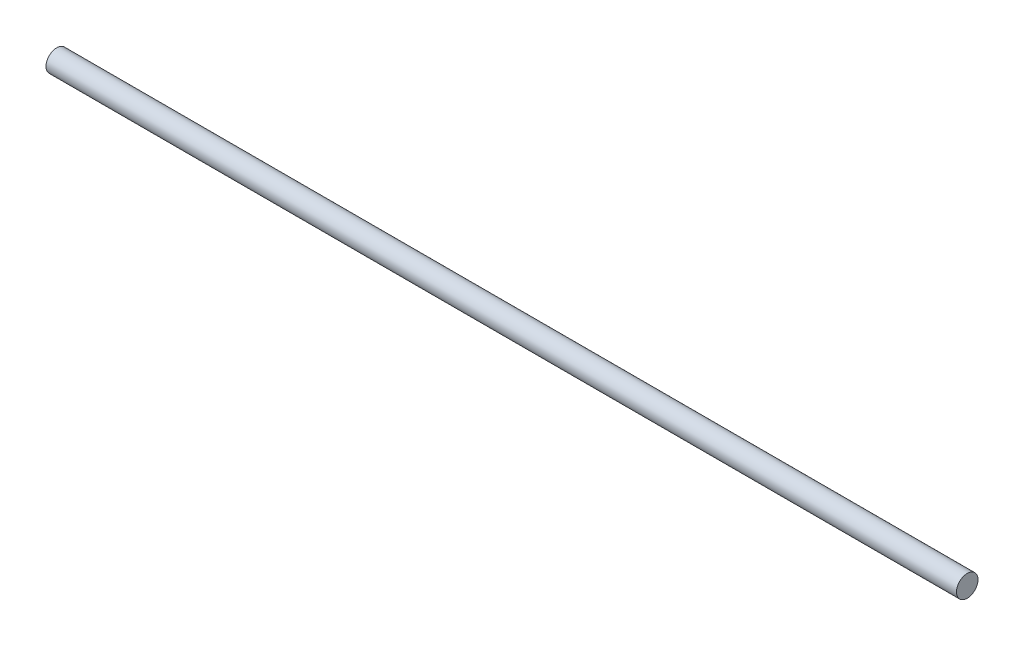
from build123d import *

# Parameters (mm, degrees)
SKETCH_1_R      = 4
EXTRUDE_1_DEPTH = 338


with BuildPart() as part:
    # Эскиз1 → Бобышка-Вытянуть1 (new body)
    with BuildSketch(Plane(origin=(0, 0, 0), x_dir=(0, 0, -1), z_dir=(1, 0, 0))):
        Circle(SKETCH_1_R)
    extrude(amount=EXTRUDE_1_DEPTH)


solid = part.part
